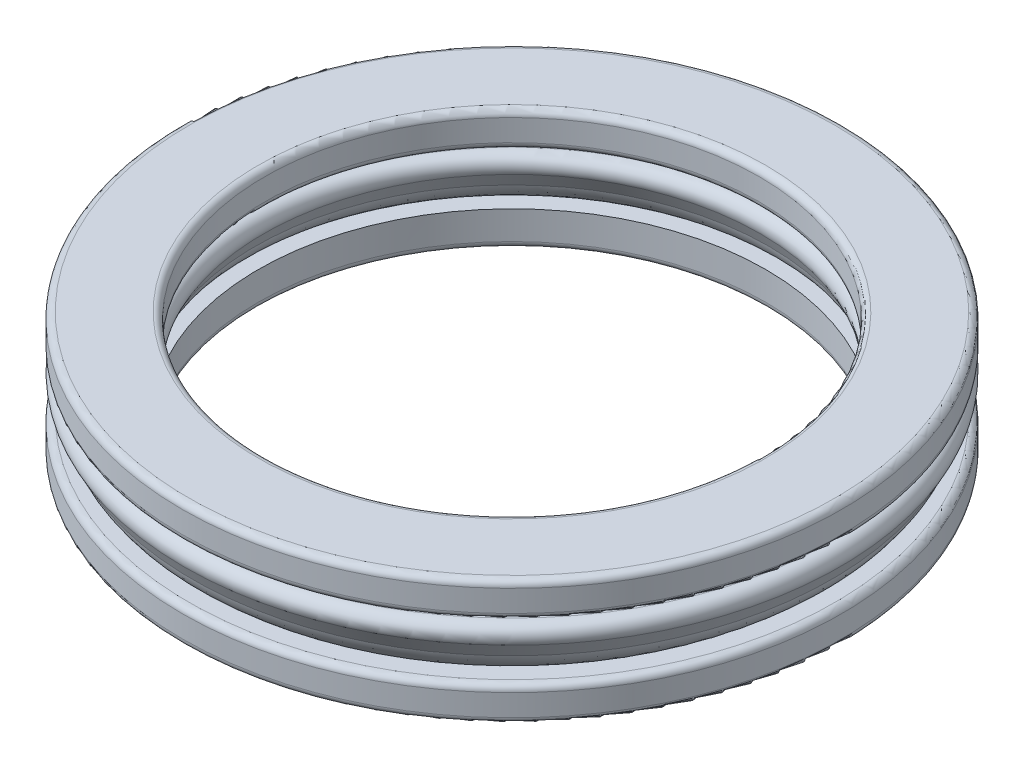
from build123d import *

# Parameters (mm, degrees)
FILLET1_R = 1


with BuildPart() as part:
    # Sketch1 → Revolve1 (revolve)
    with BuildSketch(Plane.XY, mode=Mode.PRIVATE) as revolve1_sk:
        with BuildLine():
            Line((-41.074107625, 13.7), (-37.5, 13.7))
            Line((-37.5, 13.7), (-37.5, 19))
            Line((-37.5, 19), (-50, 19))
            Line((-50, 19), (-50, 13.7))
            Line((-50, 13.7), (-46.425892375, 13.7))
            ThreePointArc((-46.425892375, 13.7), (-46.932551338, 13.330374261), (-47.388736044, 12.9))
            Line((-47.388736044, 12.9), (-48.3, 12.9))
            ThreePointArc((-48.3, 12.9), (-49.764215293, 12.063755507), (-49.787910615, 10.377733619))
            Line((-49.787910615, 10.377733619), (-48.529163107, 8.1))
            ThreePointArc((-48.529163107, 8.1), (-47.731766324, 6.509024082), (-46.425892375, 5.3))
            Line((-46.425892375, 5.3), (-50, 5.3))
            Line((-50, 5.3), (-50, 0))
            Line((-50, 0), (-38.5, 0))
            Line((-38.5, 0), (-38.5, 5.3))
            Line((-38.5, 5.3), (-41.074107625, 5.3))
            ThreePointArc((-41.074107625, 5.3), (-39.768233676, 6.509024082), (-38.970836893, 8.1))
            Line((-38.970836893, 8.1), (-37.712089385, 10.377733619))
            ThreePointArc((-37.712089385, 10.377733619), (-37.735784707, 12.063755507), (-39.2, 12.9))
            Line((-39.2, 12.9), (-40.111263956, 12.9))
            ThreePointArc((-40.111263956, 12.9), (-40.567448662, 13.330374261), (-41.074107625, 13.7))
        make_face()
    revolve(revolve1_sk.sketch.rotate(Axis((0, 0, 0), (0, 1, 0)), 270), axis=Axis((0, 0, 0), (0, 1, 0)))

    # Fillet1
    fillet1_edges = [part.edges().sort_by_distance(p)[0] for p in [
        (0, 5.3, 50),
        (0, 13.7, 50),
        (0, 19, 50),
        (0, 19, 37.5),
        (0, 13.7, 37.5),
        (0, 0, 38.5),
        (0, 0, 50),
    ]]
    fillet(fillet1_edges, radius=FILLET1_R)


solid = part.part
